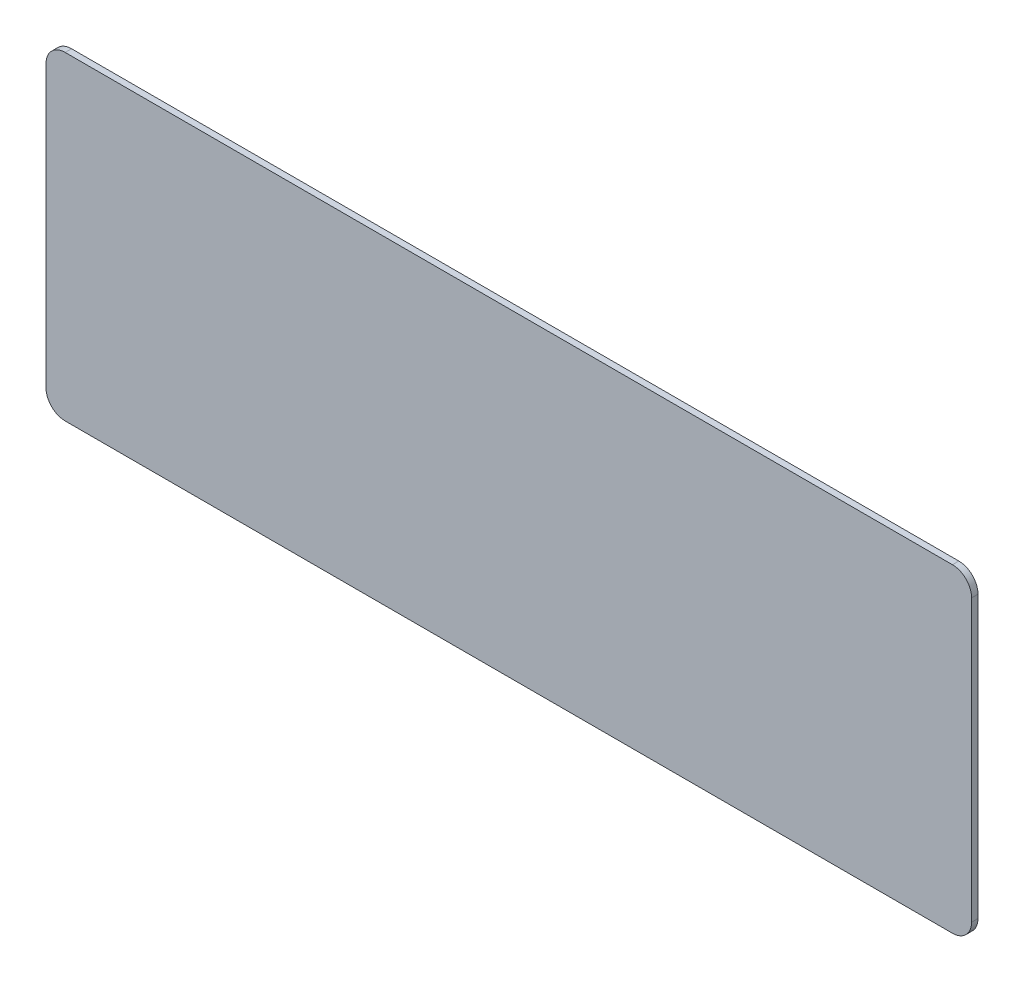
from build123d import *

# Parameters (mm, degrees)
SKETCH_1_W      = 145
SKETCH_1_H      = 50
EXTRUDE_1_DEPTH = 1
FILLET_1_R      = 3


with BuildPart() as part:
    # 草图1 → 凸台-拉伸1 (new body)
    with BuildSketch(Plane.XY):
        Rectangle(SKETCH_1_W, SKETCH_1_H)
    extrude(amount=EXTRUDE_1_DEPTH)

    # 圆角1
    fillet_1_edges = [part.edges().sort_by_distance(p)[0] for p in [
        (72.5, -25, 0.5),
        (-72.5, -25, 0.5),
        (-72.5, 25, 0.5),
        (72.5, 25, 0.5),
    ]]
    fillet(fillet_1_edges, radius=FILLET_1_R)


solid = part.part
